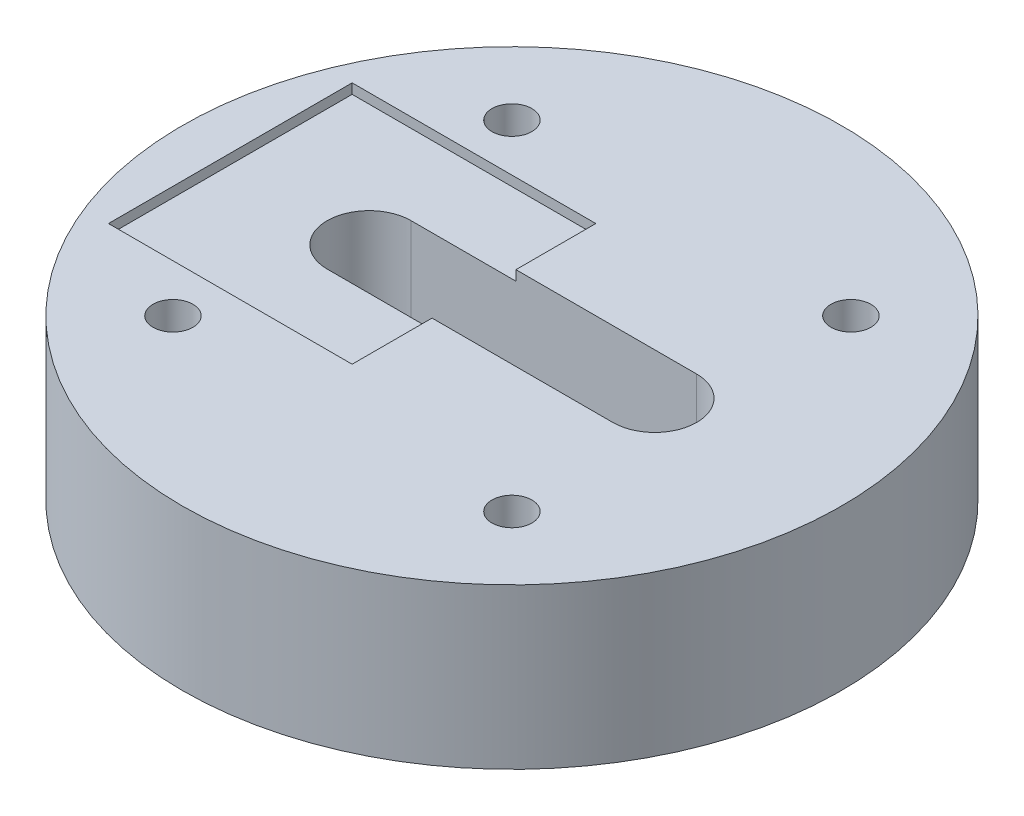
from build123d import *

# Parameters (mm, degrees)
SKETCH_1_R               = 16.5
EXTRUDE_1_DEPTH          = 8
SKETCH_1_5_R             = 16.5
SKETCH_1_5_R_2           = 15.5
EXTRUDE_2_DEPTH          = 6
SKETCH_2_R               = 2.1
SKETCH_2_W               = 8.5
SKETCH_2_H               = 4.2
CUT_EXTRUDE_1_DEPTH      = 25.667792767
SKETCH_3_R               = 2.1
SKETCH_3_W               = 14.3
SKETCH_3_H               = 4.2
CUT_EXTRUDE_2_DEPTH      = 6
SKETCH_4_R               = 0.4
CUT_EXTRUDE_3_DEPTH      = 2
SKETCH_5_W               = 12.2
SKETCH_5_H               = 12.2
SKETCH_5_W_2             = 7
SKETCH_5_H_2             = 3.2
CUT_EXTRUDE_4_DEPTH      = 0.5
SKETCH_6_R               = 1
CUT_EXTRUDE_5_DEPTH      = 25.667792767
SKETCH_6_3_R             = 1.5
CUT_EXTRUDE_6_DEPTH      = 6
PATTERN_CIRCULAR_1_COUNT = 4


with BuildPart() as part:
    # 草图1 → 凸台-拉伸1 (new body)
    with BuildSketch(Plane(origin=(0, 0, 0), x_dir=(1, 0, 0), z_dir=(0, 1, 0))):
        with Locations(Location((0, 0, 0), (0, 0, 270))):
            Circle(SKETCH_1_R)
    extrude(amount=EXTRUDE_1_DEPTH)

    # 草图1<5> → 凸台-拉伸2 (add)
    with BuildSketch(Plane(origin=(0, 0, 0), x_dir=(1, 0, 0), z_dir=(0, 1, 0))):
        with Locations(Location((0, 0, 0), (0, 0, 270))):
            Circle(SKETCH_1_5_R)
        Circle(SKETCH_1_5_R_2, mode=Mode.SUBTRACT)
    extrude(amount=EXTRUDE_2_DEPTH)

    # 草图2 → 切除-拉伸1 (cut, through all)
    with BuildSketch(Plane(origin=(0, 8, 0), x_dir=(1, 0, 0), z_dir=(0, 1, 0))):
        with Locations((4.25, 0)):
            Circle(SKETCH_2_R)
        with Locations((-4.25, 0)):
            Circle(SKETCH_2_R)
        Rectangle(SKETCH_2_W, SKETCH_2_H)
    extrude(amount=-CUT_EXTRUDE_1_DEPTH, mode=Mode.SUBTRACT)

    # 草图3 → 切除-拉伸2 (cut)
    with BuildSketch(Plane(origin=(0, 8, 0), x_dir=(1, 0, 0), z_dir=(0, 1, 0))):
        with Locations((-7.15, 0)):
            Circle(SKETCH_3_R)
        with Locations((7.15, 0)):
            Circle(SKETCH_3_R)
        Rectangle(SKETCH_3_W, SKETCH_3_H)
    extrude(amount=-CUT_EXTRUDE_2_DEPTH, mode=Mode.SUBTRACT)

    # 草图4 → 切除-拉伸3 (cut)
    with BuildSketch(Plane(origin=(0, 2, 0), x_dir=(1, 0, 0), z_dir=(0, 1, 0))):
        with Locations(Location((-7.7, 0, 0), (0, 0, 270))):
            Circle(SKETCH_4_R)
        with Locations(Location((7.7, 0, 0), (0, 0, 270))):
            Circle(SKETCH_4_R)
    extrude(amount=-CUT_EXTRUDE_3_DEPTH, mode=Mode.SUBTRACT)

    # 草图5 → 切除-拉伸4 (cut)
    with BuildSketch(Plane(origin=(0, 8, 0), x_dir=(1, 0, 0), z_dir=(0, 1, 0))):
        with Locations((-8, 0)):
            Rectangle(SKETCH_5_W, SKETCH_5_H)
        with Locations((1.6, 0)):
            Rectangle(SKETCH_5_W_2, SKETCH_5_H_2)
    extrude(amount=-CUT_EXTRUDE_4_DEPTH, mode=Mode.SUBTRACT)

    # 草图6 → 切除-拉伸5 (cut, through all)
    with BuildSketch(Plane.XZ):
        with Locations(Location((8.485281374, 8.485281374, 0), (0, 0, 270))):
            Circle(SKETCH_6_R)
    cut_extrude_5 = extrude(amount=-CUT_EXTRUDE_5_DEPTH, mode=Mode.SUBTRACT)

    # 草图6<3> → 切除-拉伸6 (cut)
    with BuildSketch(Plane.XZ):
        with Locations(Location((8.485281374, 8.485281374, 0), (0, 0, 270))):
            Circle(SKETCH_6_3_R)
    cut_extrude_6 = extrude(amount=-CUT_EXTRUDE_6_DEPTH, mode=Mode.SUBTRACT)

    # 阵列(圆周)1: 切除-拉伸5, 切除-拉伸6 ×4 about axis
    pattern_circular_1_axis = Axis((0, 0, 0), (0, 1, 0))
    add([cut_extrude_5.rotate(pattern_circular_1_axis, i * 360 / PATTERN_CIRCULAR_1_COUNT) for i in range(1, PATTERN_CIRCULAR_1_COUNT)], mode=Mode.SUBTRACT)
    add([cut_extrude_6.rotate(pattern_circular_1_axis, i * 360 / PATTERN_CIRCULAR_1_COUNT) for i in range(1, PATTERN_CIRCULAR_1_COUNT)], mode=Mode.SUBTRACT)


solid = part.part
